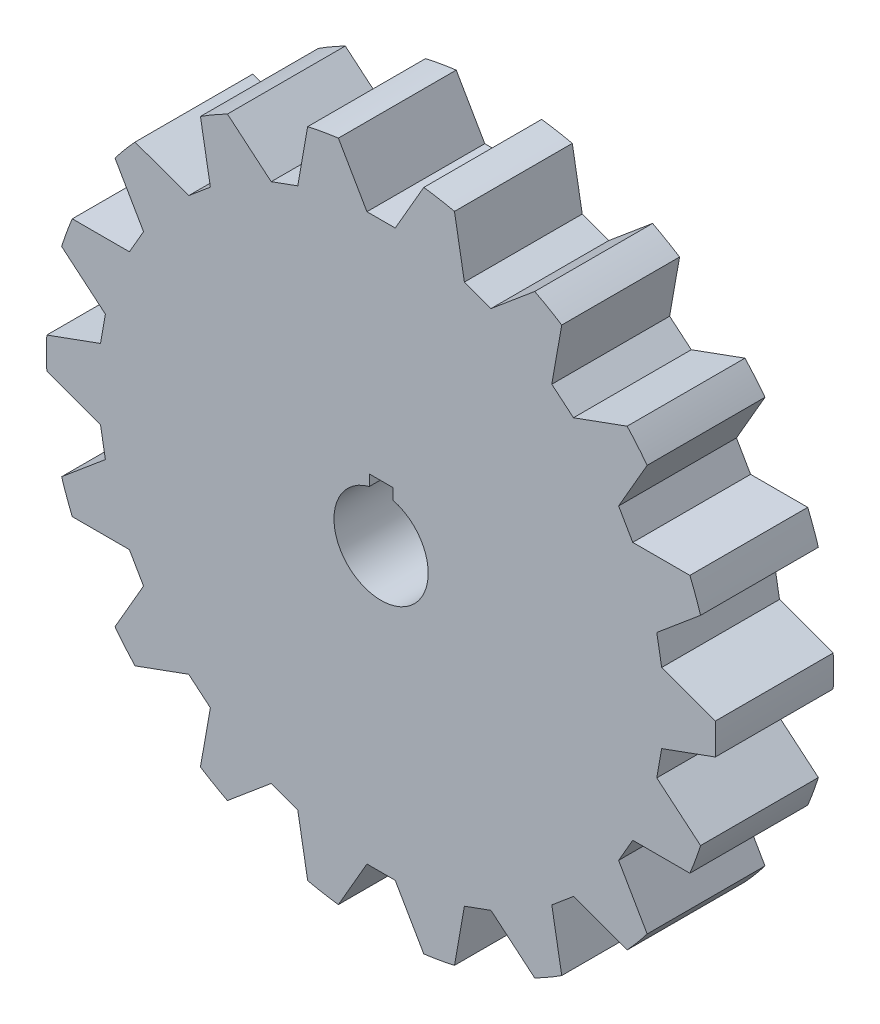
from build123d import *

# Parameters (mm, degrees)
BOSS_EXTRUDE1_DEPTH = 25


with BuildPart() as part:
    # Sketch1 → Boss-Extrude1 (new body)
    with BuildSketch(Plane.XY):
        with BuildLine():
            Line((-3, 59.924953066), (3, 59.924953066))
            Line((3, 59.924953066), (9.05913636, 70.419685092))
            ThreePointArc((9.05913636, 70.419685092), (12.329020614, 69.921350464), (15.5721472, 69.271265555))
            Line((15.5721472, 69.271265555), (17.676463174, 57.337096627))
            Line((17.676463174, 57.337096627), (23.314618899, 55.284975767))
            Line((23.314618899, 55.284975767), (32.597754376, 63.074451322))
            ThreePointArc((32.597754376, 63.074451322), (35.5, 61.487803669), (38.325199987, 59.767709057))
            Line((38.325199987, 59.767709057), (36.220884013, 47.83354013))
            Line((36.220884013, 47.83354013), (40.817150671, 43.976814472))
            Line((40.817150671, 43.976814472), (52.204602123, 48.121507844))
            ThreePointArc((52.204602123, 48.121507844), (54.389155461, 45.637920288), (56.455668036, 43.05528477))
            Line((56.455668036, 43.05528477), (50.396531676, 32.560552745))
            Line((50.396531676, 32.560552745), (53.396531676, 27.364400322))
            Line((53.396531676, 27.364400322), (65.514804396, 27.364400322))
            ThreePointArc((65.514804396, 27.364400322), (66.718176076, 24.283430176), (67.776749323, 21.149757711))
            Line((67.776749323, 21.149757711), (58.493613846, 13.360282156))
            Line((58.493613846, 13.360282156), (59.535502912, 7.451435638))
            Line((59.535502912, 7.451435638), (70.922954363, 3.306742265))
            ThreePointArc((70.922954363, 3.306742265), (71, 0), (70.922954363, -3.306742265))
            Line((70.922954363, -3.306742265), (59.535502912, -7.451435638))
            Line((59.535502912, -7.451435638), (58.493613846, -13.360282156))
            Line((58.493613846, -13.360282156), (67.776749323, -21.149757711))
            ThreePointArc((67.776749323, -21.149757711), (66.718176076, -24.283430176), (65.514804396, -27.364400322))
            Line((65.514804396, -27.364400322), (53.396531676, -27.364400322))
            Line((53.396531676, -27.364400322), (50.396531676, -32.560552745))
            Line((50.396531676, -32.560552745), (56.455668036, -43.05528477))
            ThreePointArc((56.455668036, -43.05528477), (54.389155461, -45.637920288), (52.204602123, -48.121507844))
            Line((52.204602123, -48.121507844), (40.817150671, -43.976814472))
            Line((40.817150671, -43.976814472), (36.220884013, -47.83354013))
            Line((36.220884013, -47.83354013), (38.325199987, -59.767709057))
            ThreePointArc((38.325199987, -59.767709057), (35.5, -61.487803669), (32.597754376, -63.074451322))
            Line((32.597754376, -63.074451322), (23.314618899, -55.284975767))
            Line((23.314618899, -55.284975767), (17.676463174, -57.337096627))
            Line((17.676463174, -57.337096627), (15.5721472, -69.271265555))
            ThreePointArc((15.5721472, -69.271265555), (12.329020614, -69.921350464), (9.05913636, -70.419685092))
            Line((9.05913636, -70.419685092), (3, -59.924953066))
            Line((3, -59.924953066), (-3, -59.924953066))
            Line((-3, -59.924953066), (-9.05913636, -70.419685092))
            ThreePointArc((-9.05913636, -70.419685092), (-12.329020614, -69.921350464), (-15.5721472, -69.271265555))
            Line((-15.5721472, -69.271265555), (-17.676463174, -57.337096627))
            Line((-17.676463174, -57.337096627), (-23.314618899, -55.284975767))
            Line((-23.314618899, -55.284975767), (-32.597754376, -63.074451322))
            ThreePointArc((-32.597754376, -63.074451322), (-35.5, -61.487803669), (-38.325199987, -59.767709057))
            Line((-38.325199987, -59.767709057), (-36.220884013, -47.83354013))
            Line((-36.220884013, -47.83354013), (-40.817150671, -43.976814472))
            Line((-40.817150671, -43.976814472), (-52.204602123, -48.121507844))
            ThreePointArc((-52.204602123, -48.121507844), (-54.389155461, -45.637920288), (-56.455668036, -43.05528477))
            Line((-56.455668036, -43.05528477), (-50.396531676, -32.560552745))
            Line((-50.396531676, -32.560552745), (-53.396531676, -27.364400322))
            Line((-53.396531676, -27.364400322), (-65.514804396, -27.364400322))
            ThreePointArc((-65.514804396, -27.364400322), (-66.718176076, -24.283430176), (-67.776749323, -21.149757711))
            Line((-67.776749323, -21.149757711), (-58.493613846, -13.360282156))
            Line((-58.493613846, -13.360282156), (-59.535502912, -7.451435638))
            Line((-59.535502912, -7.451435638), (-70.922954363, -3.306742265))
            ThreePointArc((-70.922954363, -3.306742265), (-71, 0), (-70.922954363, 3.306742265))
            Line((-70.922954363, 3.306742265), (-59.535502912, 7.451435638))
            Line((-59.535502912, 7.451435638), (-58.493613846, 13.360282156))
            Line((-58.493613846, 13.360282156), (-67.776749323, 21.149757711))
            ThreePointArc((-67.776749323, 21.149757711), (-66.718176076, 24.283430176), (-65.514804396, 27.364400322))
            Line((-65.514804396, 27.364400322), (-53.396531676, 27.364400322))
            Line((-53.396531676, 27.364400322), (-50.396531676, 32.560552745))
            Line((-50.396531676, 32.560552745), (-56.455668036, 43.05528477))
            ThreePointArc((-56.455668036, 43.05528477), (-54.389155461, 45.637920288), (-52.204602123, 48.121507844))
            Line((-52.204602123, 48.121507844), (-40.817150671, 43.976814472))
            Line((-40.817150671, 43.976814472), (-36.220884013, 47.83354013))
            Line((-36.220884013, 47.83354013), (-38.325199987, 59.767709057))
            ThreePointArc((-38.325199987, 59.767709057), (-35.5, 61.487803669), (-32.597754376, 63.074451322))
            Line((-32.597754376, 63.074451322), (-23.314618899, 55.284975767))
            Line((-23.314618899, 55.284975767), (-17.676463174, 57.337096627))
            Line((-17.676463174, 57.337096627), (-15.5721472, 69.271265555))
            ThreePointArc((-15.5721472, 69.271265555), (-12.329020614, 69.921350464), (-9.05913636, 70.419685092))
            Line((-9.05913636, 70.419685092), (-3, 59.924953066))
        make_face()
        with BuildLine():
            Line((2.5, 9.682458366), (2.5, 12))
            Line((2.5, 12), (-2.5, 12))
            Line((-2.5, 12), (-2.5, 9.682458366))
            ThreePointArc((-2.5, 9.682458366), (0, -10), (2.5, 9.682458366))
        make_face(mode=Mode.SUBTRACT)
    extrude(amount=-BOSS_EXTRUDE1_DEPTH)


solid = part.part
